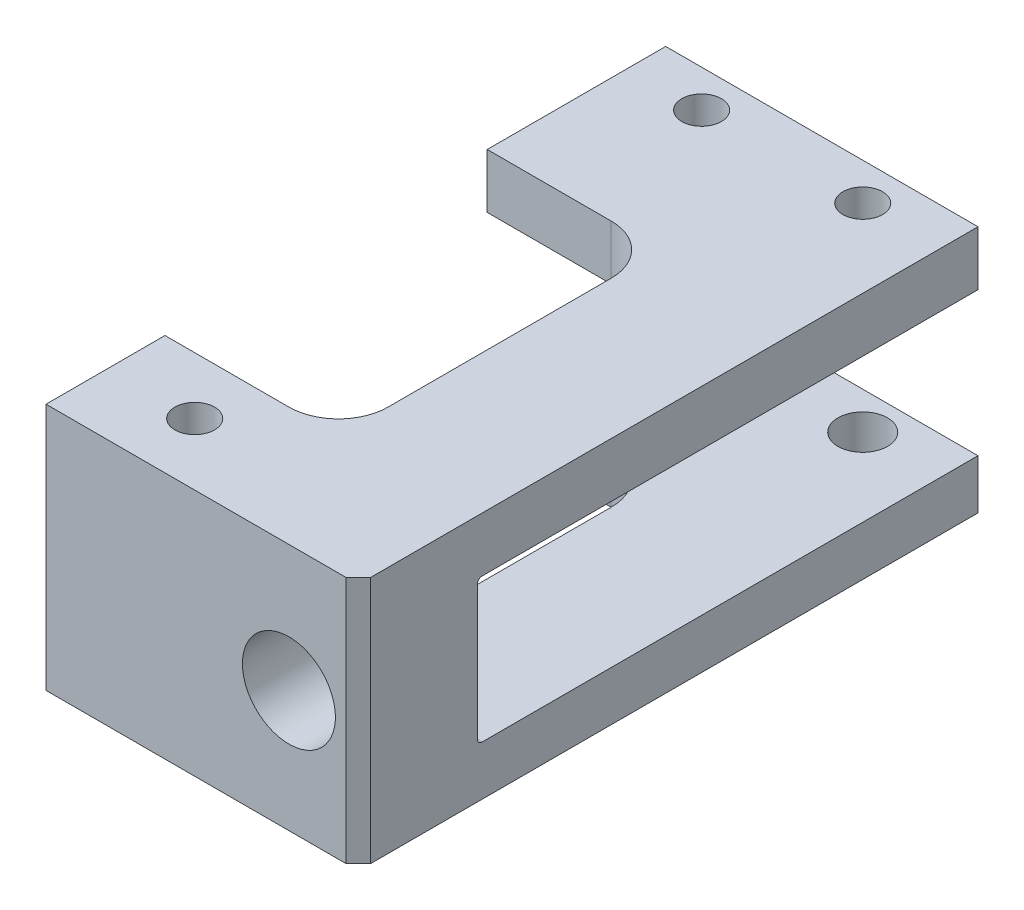
from build123d import *

# Parameters (mm, degrees)
SKETCH1_W                   = 12.6
SKETCH1_H                   = 25
BOSS_EXTRUDE1_DEPTH         = 10
CUT_EXTRUDE1_START          = -4.8
SKETCH2_W                   = 7
SKETCH2_H                   = 5.8
CUT_EXTRUDE1_DEPTH          = 23.853028767
SKETCH3_W                   = 20.2
SKETCH3_H                   = 5.8
CUT_EXTRUDE2_DEPTH          = 18.47140521
SKETCH6_R                   = 1
CUT_EXTRUDE5_DEPTH          = 17.122654868
TAP_DRILL_FOR_M2X0_4_TAP1_D = 1.6
CUT_EXTRUDE6_DEPTH          = 17.122654868
CUT_EXTRUDE6_DEPTH_BACK     = 17.122654868
SKETCH9_W                   = 7
SKETCH9_H                   = 13
FILLET1_R                   = 2
SKETCH4_R                   = 1.875
CUT_EXTRUDE7_DEPTH          = 24.403632197
TAP_DRILL_FOR_M2X0_4_TAP4_D = 1.6
FILLET3_R                   = 0.2
CHAMFER2_SIZE               = 0.5
SKETCH25_R                  = 1.5
CUT_EXTRUDE19_DEPTH         = 1


with BuildPart() as part:
    # Sketch1 → Boss-Extrude1 (new body)
    with BuildSketch(Plane(origin=(0, 0, 0), x_dir=(1, 0, 0), z_dir=(0, 1, 0))):
        Rectangle(SKETCH1_W, SKETCH1_H)
    extrude(amount=BOSS_EXTRUDE1_DEPTH)

    # Sketch2 → Cut-Extrude1 (cut, through all)
    with BuildSketch(Plane.XY.offset(12.5).offset(CUT_EXTRUDE1_START)):
        with Locations((-2.8, 4.9)):
            Rectangle(SKETCH2_W, SKETCH2_H)
    extrude(amount=-CUT_EXTRUDE1_DEPTH, mode=Mode.SUBTRACT)

    # Sketch3 → Cut-Extrude2 (cut, through all)
    with BuildSketch(Plane.ZY.offset(-0.7)):
        with Locations((-2.4, 4.9)):
            Rectangle(SKETCH3_W, SKETCH3_H)
    extrude(amount=-CUT_EXTRUDE2_DEPTH, mode=Mode.SUBTRACT)

    # Sketch6 → Cut-Extrude5 (cut, through all)
    with BuildSketch(Plane(origin=(0, 2, 0), x_dir=(1, 0, 0), z_dir=(0, 1, 0))):
        with Locations((3.15, 11)):
            Circle(SKETCH6_R)
        with Locations((-3.35, 11)):
            Circle(SKETCH6_R)
    extrude(amount=-CUT_EXTRUDE5_DEPTH, mode=Mode.SUBTRACT)

    # Tap Drill for M2x0.4 Tap1 (through all)
    with Locations(Plane(origin=(3.15, 10, -11), x_dir=(0, 0, 1), z_dir=(0, 1, 0))):
        with Locations((0, 0), (0, -6.5)):
            Hole(TAP_DRILL_FOR_M2X0_4_TAP1_D / 2)

    # Sketch9 → Cut-Extrude6 (cut, two sides: drawn at the far end of the back side and taken through both)
    with BuildSketch(Plane(origin=(0, 2, 0), x_dir=(1, 0, 0), z_dir=(0, 1, 0)).offset(-CUT_EXTRUDE6_DEPTH_BACK)):
        with Locations((-2.8, -1.2)):
            Rectangle(SKETCH9_W, SKETCH9_H)
    extrude(amount=CUT_EXTRUDE6_DEPTH + CUT_EXTRUDE6_DEPTH_BACK, mode=Mode.SUBTRACT)

    # Fillet1
    fillet1_edges = [part.edges().sort_by_distance(p)[0] for p in [
        (0.7, 1, -5.3),
        (0.7, 1, 7.7),
        (0.7, 8.9, -5.3),
        (0.7, 8.9, 7.7),
    ]]
    fillet(fillet1_edges, radius=FILLET1_R)

    # Sketch4 → Cut-Extrude7 (cut, through all)
    with BuildSketch(Plane(origin=(0, 0, 7.7), x_dir=(-1, 0, 0), z_dir=(0, 0, -1))):
        with Locations((-3.5, 4.9)):
            Circle(SKETCH4_R)
    extrude(amount=-CUT_EXTRUDE7_DEPTH, mode=Mode.SUBTRACT)

    # Tap Drill for M2x0.4 Tap4 (through all)
    with Locations(Plane(origin=(-2.8, 10, 10), x_dir=(0, 0, 1), z_dir=(0, 1, 0))):
        with Locations((0, 0)):
            Hole(TAP_DRILL_FOR_M2X0_4_TAP4_D / 2)

    # Fillet3
    fillet3_edges = [part.edges().sort_by_distance(p)[0] for p in [
        (2.5, 2, 7.7),
        (2.5, 7.8, 7.7),
    ]]
    fillet(fillet3_edges, radius=FILLET3_R)

    # Chamfer2
    chamfer2_edges = [part.edges().sort_by_distance(p)[0] for p in [
        (6.3, 5, 12.5),
    ]]
    chamfer(chamfer2_edges, length=CHAMFER2_SIZE)

    # Sketch25 → Cut-Extrude19 (cut)
    with BuildSketch(Plane.XZ):
        with Locations((-2.8, 10)):
            Circle(SKETCH25_R)
    extrude(amount=-CUT_EXTRUDE19_DEPTH, mode=Mode.SUBTRACT)


solid = part.part
